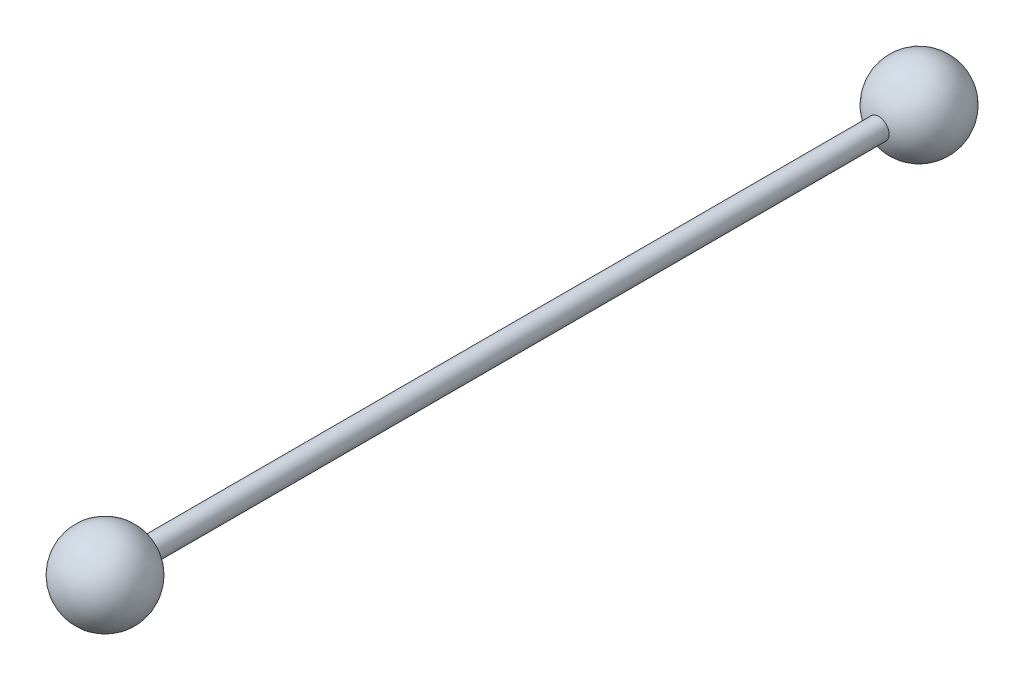
from build123d import *

# Parameters (mm, degrees)
SKETCH5_R                = 5
SKETCH5_R_2              = 3.5
BOSS_EXTRUDE2_DEPTH      = 4
BOSS_EXTRUDE3_DEPTH      = 354
BOSS_EXTRUDE3_DEPTH_BACK = 4
SKETCH5_2_R              = 5
SKETCH5_2_R_2            = 3.5


with BuildPart() as part:
    # Sketch4 → Revolve1 (revolve)
    with BuildSketch(Plane.XY):
        with BuildLine():
            Line((-3.046357616, 14.635761589), (-3.046357616, 10.635761589))
            ThreePointArc((-3.046357616, 10.635761589), (12.953642384, -5.364238411), (-3.046357616, -21.364238411))
            Line((-3.046357616, -21.364238411), (-3.046357616, -25.364238411))
            ThreePointArc((-3.046357616, -25.364238411), (16.953642384, -5.364238411), (-3.046357616, 14.635761589))
        make_face()
    revolve(axis=Axis((-3.046357616, 14.635761589, 0), (0, -1, 0)))

    # Sketch5 → Boss-Extrude2 (add)
    with BuildSketch(Plane.XY.offset(20)):
        with Locations((-3.046357616, -5.364238411)):
            Circle(SKETCH5_R)
        with Locations((-3.046357616, -5.364238411)):
            Circle(SKETCH5_R_2, mode=Mode.SUBTRACT)
    extrude(amount=-BOSS_EXTRUDE2_DEPTH)

    # Sketch5<2> → Boss-Extrude3 (add, two sides: drawn at the far end of the back side and taken through both)
    with BuildSketch(Plane.XY.offset(20).offset(-BOSS_EXTRUDE3_DEPTH_BACK)):
        with Locations((-3.046357616, -5.364238411)):
            Circle(SKETCH5_2_R)
        with Locations((-3.046357616, -5.364238411)):
            Circle(SKETCH5_2_R_2, mode=Mode.SUBTRACT)
    extrude(amount=BOSS_EXTRUDE3_DEPTH + BOSS_EXTRUDE3_DEPTH_BACK)


with BuildPart() as body_2:
    # Sketch7 → Revolve3 (revolve)
    with BuildSketch(Plane.XY.offset(390)):
        with BuildLine():
            Line((-3.046357616, 14.635761589), (-3.046357616, 10.635761589))
            ThreePointArc((-3.046357616, 10.635761589), (12.953642384, -5.364238411), (-3.046357616, -21.364238411))
            Line((-3.046357616, -21.364238411), (-3.046357616, -25.364238411))
            ThreePointArc((-3.046357616, -25.364238411), (16.953642384, -5.364238411), (-3.046357616, 14.635761589))
        make_face()
    revolve(axis=Axis((-3.046357616, 14.635761589, 390), (0, -1, 0)))


solid = Compound([part.part, body_2.part])
